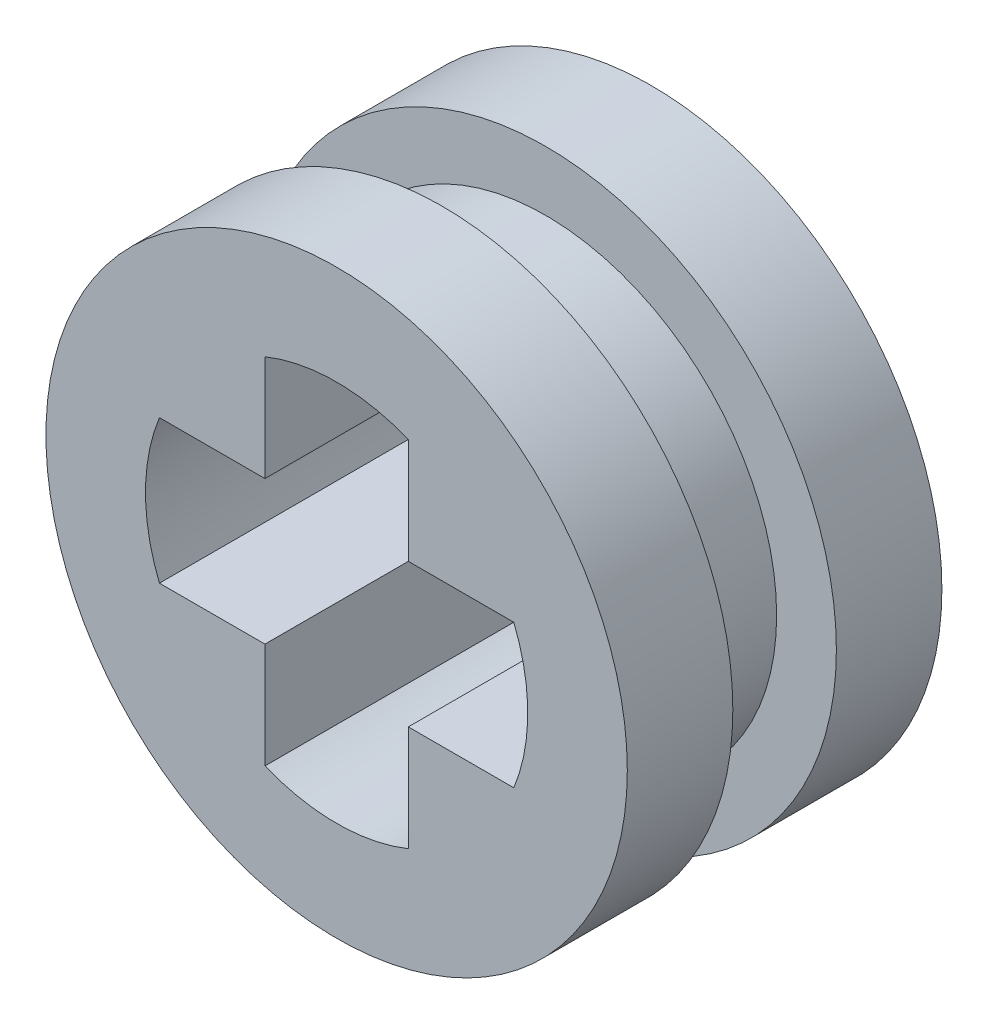
from build123d import *

# Parameters (mm, degrees)
SKETCH1_R           = 3.65
BOSS_EXTRUDE1_DEPTH = 1.975
SKETCH2_OUTSIDE_W   = 11.51
SKETCH2_OUTSIDE_H   = 11.51
SKETCH2_OUTSIDE_R   = 2.9
CUT_EXTRUDE1_DEPTH  = 0.65


with BuildPart() as part:
    # Sketch1 → Boss-Extrude1 (new, symmetric)
    with BuildSketch(Plane.XY):
        Circle(SKETCH1_R)
        with BuildLine():
            ThreePointArc((0.9, -2.224859546), (0, -2.4), (-0.9, -2.224859546))
            Line((-0.9, -2.224859546), (-0.9, -0.9))
            Line((-0.9, -0.9), (-2.224859546, -0.9))
            ThreePointArc((-2.224859546, -0.9), (-2.4, 0), (-2.224859546, 0.9))
            Line((-2.224859546, 0.9), (-0.9, 0.9))
            Line((-0.9, 0.9), (-0.9, 2.224859546))
            ThreePointArc((-0.9, 2.224859546), (0, 2.4), (0.9, 2.224859546))
            Line((0.9, 2.224859546), (0.9, 0.9))
            Line((0.9, 0.9), (2.224859546, 0.9))
            ThreePointArc((2.224859546, 0.9), (2.4, 0), (2.224859546, -0.9))
            Line((2.224859546, -0.9), (0.9, -0.9))
            Line((0.9, -0.9), (0.9, -2.224859546))
        make_face(mode=Mode.SUBTRACT)
    extrude(amount=BOSS_EXTRUDE1_DEPTH, both=True)

    # Sketch2 outside → Cut-Extrude1 (cut, symmetric)
    with BuildSketch(Plane.XY):
        Rectangle(SKETCH2_OUTSIDE_W, SKETCH2_OUTSIDE_H)
        Circle(SKETCH2_OUTSIDE_R, mode=Mode.SUBTRACT)
    extrude(amount=CUT_EXTRUDE1_DEPTH, both=True, mode=Mode.SUBTRACT)


solid = part.part
